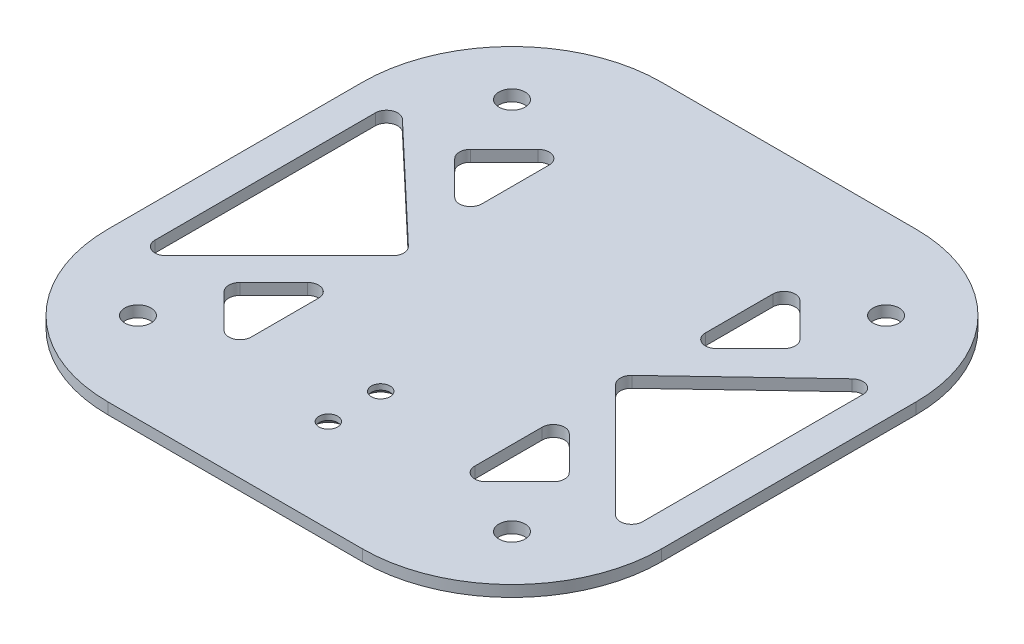
from build123d import *

# Parameters (mm, degrees)
SKETCH2_W           = 148
SKETCH2_H           = 148
SKETCH2_R           = 3.5
SKETCH2_R_2         = 2.5
BOSS_EXTRUDE1_DEPTH = 3
FILLET1_R           = 40
CHAMFER1_SIZE       = 1.5
SKETCH3_W           = 25.243080612
SKETCH3_H           = 38.292469741
BOSS_EXTRUDE2_DEPTH = 3


with BuildPart() as part:
    # Sketch2 → Boss-Extrude1 (new body)
    with BuildSketch(Plane(origin=(0, 0, 0), x_dir=(1, 0, 0), z_dir=(0, 1, 0))):
        with Locations((50, -50)):
            Rectangle(SKETCH2_W, SKETCH2_H)
        with Locations(Location((0, 0, 0), (0, 0, 270))):
            Circle(SKETCH2_R, mode=Mode.SUBTRACT)
        with Locations(Location((0, -100, 0), (0, 0, 270))):
            Circle(SKETCH2_R, mode=Mode.SUBTRACT)
        with Locations(Location((100, 0, 0), (0, 0, 270))):
            Circle(SKETCH2_R, mode=Mode.SUBTRACT)
        with Locations(Location((100, -100, 0), (0, 0, 270))):
            Circle(SKETCH2_R, mode=Mode.SUBTRACT)
        with Locations(Location((50, -0.904618286, 0), (0, 0, 270))):
            Circle(SKETCH2_R_2, mode=Mode.SUBTRACT)
        with Locations(Location((50, -14.904618286, 0), (0, 0, 270))):
            Circle(SKETCH2_R_2, mode=Mode.SUBTRACT)
        with Locations(Location((50, -99.095381714, 0), (0, 0, 90))):
            Circle(SKETCH2_R_2, mode=Mode.SUBTRACT)
        with Locations(Location((50, -85.095381714, 0), (0, 0, 90))):
            Circle(SKETCH2_R_2, mode=Mode.SUBTRACT)
        with BuildLine():
            Line((-15.182460642, -21.358338014), (-15.182460642, -80.245012021))
            ThreePointArc((-15.182460642, -80.245012021), (-13.330510939, -83.016650619), (-10.061140298, -82.366332365))
            Line((-10.061140298, -82.366332365), (20.183871723, -52.121320344))
            ThreePointArc((20.183871723, -52.121320344), (21.062273515, -49.959169765), (20.125348516, -47.821728214))
            Line((20.125348516, -47.821728214), (-10.119663505, -19.180066228))
            ThreePointArc((-10.119663505, -19.180066228), (-13.368126824, -18.602581184), (-15.182460642, -21.358338014))
        make_face(mode=Mode.SUBTRACT)
        with BuildLine():
            Line((110.061140298, -82.366332365), (79.816128277, -52.121320344))
            ThreePointArc((79.816128277, -52.121320344), (78.937726485, -49.959169765), (79.874651484, -47.821728214))
            Line((79.874651484, -47.821728214), (110.119663505, -19.180066228))
            ThreePointArc((110.119663505, -19.180066228), (113.368126824, -18.602581184), (115.182460642, -21.358338014))
            Line((115.182460642, -21.358338014), (115.182460642, -80.245012021))
            ThreePointArc((115.182460642, -80.245012021), (113.330510939, -83.016650619), (110.061140298, -82.366332365))
        make_face(mode=Mode.SUBTRACT)
        with BuildLine():
            Line((5.995336985, -21.301386572), (15.004028172, -30.310077759))
            ThreePointArc((15.004028172, -30.310077759), (18.273398813, -30.960396013), (20.125348516, -28.188757415))
            Line((20.125348516, -28.188757415), (20.125348516, -10.171375041))
            ThreePointArc((20.125348516, -10.171375041), (18.273398813, -7.399736444), (15.004028172, -8.050054698))
            Line((15.004028172, -8.050054698), (5.995336985, -17.058745885))
            ThreePointArc((5.995336985, -17.058745885), (5.116657329, -19.180066228), (5.995336985, -21.301386572))
        make_face(mode=Mode.SUBTRACT)
        with BuildLine():
            Line((5.995336985, -78.698613428), (15.004028172, -69.689922241))
            ThreePointArc((15.004028172, -69.689922241), (18.273398813, -69.039603987), (20.125348516, -71.811242585))
            Line((20.125348516, -71.811242585), (20.125348516, -89.828624959))
            ThreePointArc((20.125348516, -89.828624959), (18.273398813, -92.600263556), (15.004028172, -91.949945302))
            Line((15.004028172, -91.949945302), (5.995336985, -82.941254115))
            ThreePointArc((5.995336985, -82.941254115), (5.116657329, -80.819933772), (5.995336985, -78.698613428))
        make_face(mode=Mode.SUBTRACT)
        with BuildLine():
            Line((79.874651484, -71.811242585), (79.874651484, -89.828624959))
            ThreePointArc((79.874651484, -89.828624959), (81.726601187, -92.600263556), (84.995971828, -91.949945302))
            Line((84.995971828, -91.949945302), (94.004663015, -82.941254115))
            ThreePointArc((94.004663015, -82.941254115), (94.883342671, -80.819933772), (94.004663015, -78.698613428))
            Line((94.004663015, -78.698613428), (84.995971828, -69.689922241))
            ThreePointArc((84.995971828, -69.689922241), (81.726601187, -69.039603987), (79.874651484, -71.811242585))
        make_face(mode=Mode.SUBTRACT)
        with BuildLine():
            Line((94.004663015, -21.301386572), (84.995971828, -30.310077759))
            ThreePointArc((84.995971828, -30.310077759), (81.726601187, -30.960396013), (79.874651484, -28.188757415))
            Line((79.874651484, -28.188757415), (79.874651484, -10.171375041))
            ThreePointArc((79.874651484, -10.171375041), (81.726601187, -7.399736444), (84.995971828, -8.050054698))
            Line((84.995971828, -8.050054698), (94.004663015, -17.058745885))
            ThreePointArc((94.004663015, -17.058745885), (94.883342671, -19.180066228), (94.004663015, -21.301386572))
        make_face(mode=Mode.SUBTRACT)
    extrude(amount=BOSS_EXTRUDE1_DEPTH)

    # Fillet1
    fillet1_edges = [part.edges().sort_by_distance(p)[0] for p in [
        (124, 1.5, 124),
        (-24, 1.5, 124),
        (-24, 1.5, -24),
        (124, 1.5, -24),
    ]]
    fillet(fillet1_edges, radius=FILLET1_R)

    # Chamfer1
    chamfer1_edges = [part.edges().sort_by_distance(p)[0] for p in [
        (50, 0, -1.595381714),
        (50, 0, 12.404618286),
        (50, 0, 101.595381714),
        (50, 0, 87.595381714),
    ]]
    chamfer(chamfer1_edges, length=CHAMFER1_SIZE)

    # Sketch3 → Boss-Extrude2 (add)
    with BuildSketch(Plane(origin=(0, 3, 0), x_dir=(1, 0, 0), z_dir=(0, 1, 0))):
        with Locations((50.641773236, -8.177777461)):
            Rectangle(SKETCH3_W, SKETCH3_H)
    extrude(amount=-BOSS_EXTRUDE2_DEPTH)


solid = part.part
